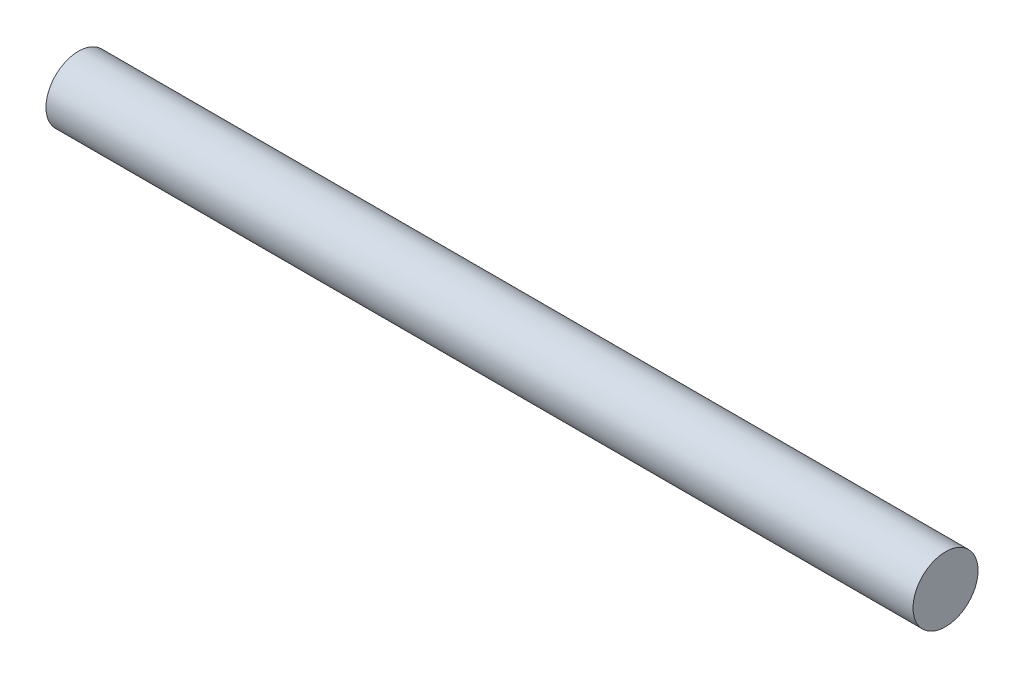
from build123d import *

# Parameters (mm, degrees)
ESQUISSE1_W = 160
ESQUISSE1_H = 6


with BuildPart() as part:
    # Esquisse1 → Révolution1 (revolve)
    with BuildSketch(Plane(origin=(0, 0, 0), x_dir=(1, 0, 0), z_dir=(0, 1, 0)), mode=Mode.PRIVATE) as r_volution1_sk:
        with Locations((0, 3)):
            Rectangle(ESQUISSE1_W, ESQUISSE1_H)
    revolve(r_volution1_sk.sketch.rotate(Axis((-80, 0, 0), (1, 0, 0)), 180), axis=Axis((-80, 0, 0), (1, 0, 0)))


solid = part.part
